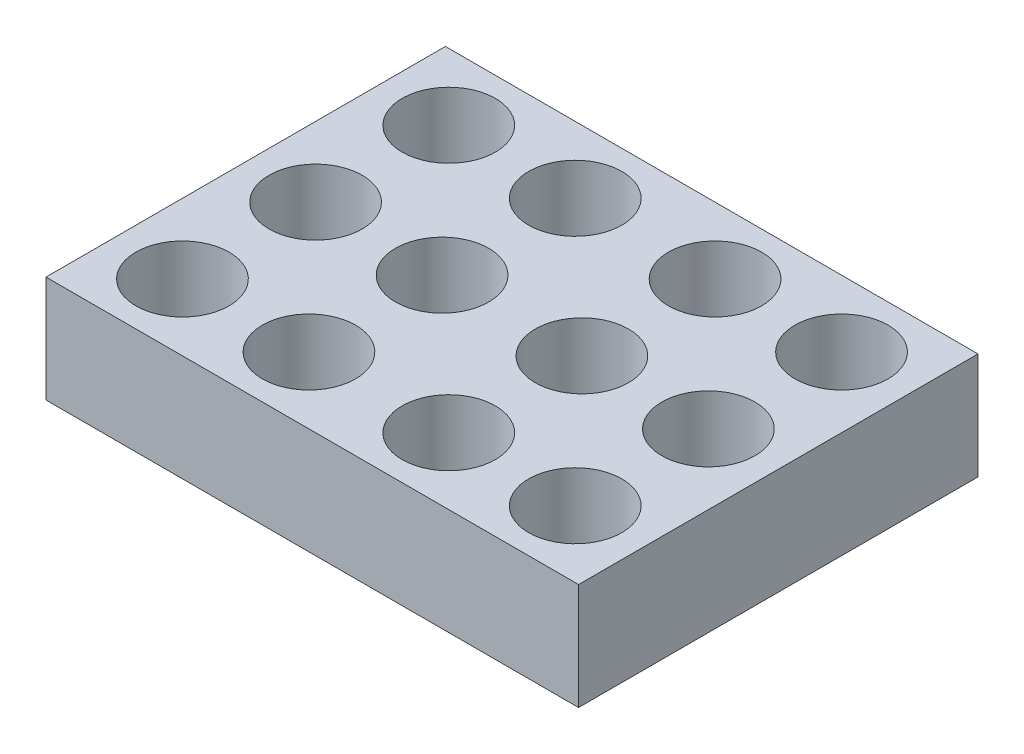
from build123d import *

# Parameters (mm, degrees)
CROQUIS1_W              = 400
CROQUIS1_H              = 300
SALIENTE_EXTRUIR1_DEPTH = 80
CROQUIS3_R              = 35
CORTAR_EXTRUIR1_DEPTH   = 70


with BuildPart() as part:
    # Croquis1 → Saliente-Extruir1 (new body)
    with BuildSketch(Plane(origin=(0, 0, 0), x_dir=(1, 0, 0), z_dir=(0, 1, 0))):
        Rectangle(CROQUIS1_W, CROQUIS1_H)
    extrude(amount=SALIENTE_EXTRUIR1_DEPTH)

    # Croquis3 → Cortar-Extruir1 (cut)
    with BuildSketch(Plane(origin=(0, 80, 0), x_dir=(1, 0, 0), z_dir=(0, 1, 0))):
        with Locations(Location((-147.5, 100, 0), (0, 0, 270))):
            Circle(CROQUIS3_R)
        with Locations(Location((-52.5, 100, 0), (0, 0, 270))):
            Circle(CROQUIS3_R)
        with Locations(Location((-147.5, 0, 0), (0, 0, 270))):
            Circle(CROQUIS3_R)
        with Locations(Location((-52.5, 0, 0), (0, 0, 270))):
            Circle(CROQUIS3_R)
        with Locations(Location((52.5, 0, 0), (0, 0, 90))):
            Circle(CROQUIS3_R)
        with Locations(Location((52.5, 100, 0), (0, 0, 90))):
            Circle(CROQUIS3_R)
        with Locations(Location((147.5, 0, 0), (0, 0, 90))):
            Circle(CROQUIS3_R)
        with Locations(Location((147.5, 100, 0), (0, 0, 90))):
            Circle(CROQUIS3_R)
        with Locations(Location((-52.5, -100, 0), (0, 0, 90))):
            Circle(CROQUIS3_R)
        with Locations(Location((-147.5, -100, 0), (0, 0, 90))):
            Circle(CROQUIS3_R)
        with Locations(Location((147.5, -100, 0), (0, 0, 270))):
            Circle(CROQUIS3_R)
        with Locations(Location((52.5, -100, 0), (0, 0, 270))):
            Circle(CROQUIS3_R)
    extrude(amount=-CORTAR_EXTRUIR1_DEPTH, mode=Mode.SUBTRACT)


solid = part.part
